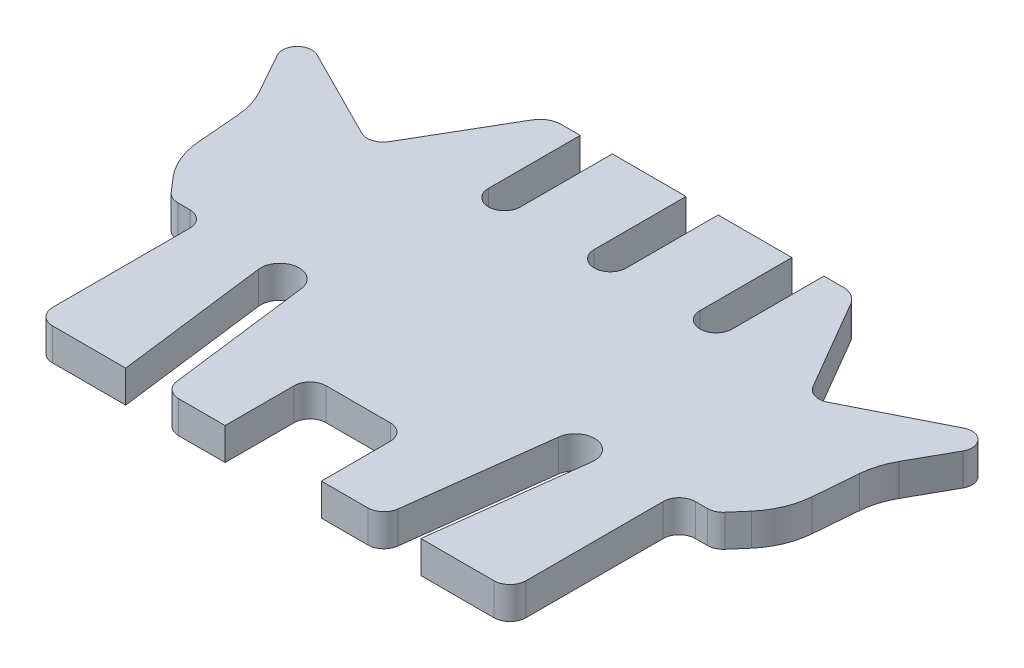
from build123d import *

# Parameters (mm, degrees)
BOSS_EXTRUDE1_DEPTH = 3
FILLET1_R           = 1.5
FILLET2_R           = 7
FILLET3_R           = 2


with BuildPart() as part:
    # Sketch1 → Boss-Extrude1 (new body)
    with BuildSketch(Plane(origin=(0, 0, 0), x_dir=(1, 0, 0), z_dir=(0, 1, 0))):
        with BuildLine():
            Line((-4.5, 7.94), (4.5, 7.94))
            Line((4.5, 7.94), (4.5, 0))
            Line((4.5, 0), (10.165, 0))
            Line((10.165, 0), (12.015, 14.649700441))
            ThreePointArc((12.015, 14.649700441), (14.026334206, 16.21), (15.586633764, 14.198665794))
            Line((15.586633764, 14.198665794), (13.793591523, 0))
            Line((13.793591523, 0), (22.124537234, 0))
            Line((22.124537234, 0), (22.124537234, 15.82))
            Line((22.124537234, 15.82), (25.434537234, 15.82))
            Line((25.434537234, 15.82), (28.504537234, 19.38))
            Line((28.504537234, 19.38), (29.164537234, 27.27))
            Line((29.164537234, 27.27), (32.041780145, 32.418380087))
            ThreePointArc((32.041780145, 32.418380087), (31.835, 34.03463387), (30.229008776, 34.31))
            Line((30.229008776, 34.31), (20.525, 29.416544335))
            Line((20.525, 29.416544335), (14.31, 40.08))
            Line((14.31, 40.08), (11.39, 40.08))
            Line((11.39, 40.08), (11.39, 31.5))
            ThreePointArc((11.39, 31.5), (9.89, 30), (8.39, 31.5))
            Line((8.39, 31.5), (8.39, 40.08))
            Line((8.39, 40.08), (1.5, 40.08))
            Line((1.5, 40.08), (1.5, 31.5))
            ThreePointArc((1.5, 31.5), (0, 30), (-1.5, 31.5))
            Line((-1.5, 31.5), (-1.5, 40.08))
            Line((-1.5, 40.08), (-8.39, 40.08))
            Line((-8.39, 40.08), (-8.39, 31.5))
            ThreePointArc((-8.39, 31.5), (-9.89, 30), (-11.39, 31.5))
            Line((-11.39, 31.5), (-11.39, 40.08))
            Line((-11.39, 40.08), (-14.31, 40.08))
            Line((-14.31, 40.08), (-20.525, 29.416544335))
            Line((-20.525, 29.416544335), (-30.229008776, 34.31))
            ThreePointArc((-30.229008776, 34.31), (-31.835, 34.03463387), (-32.041780145, 32.418380087))
            Line((-32.041780145, 32.418380087), (-29.164537234, 27.27))
            Line((-29.164537234, 27.27), (-28.504537234, 19.38))
            Line((-28.504537234, 19.38), (-25.434537234, 15.82))
            Line((-25.434537234, 15.82), (-22.124537234, 15.82))
            Line((-22.124537234, 15.82), (-22.124537234, 0))
            Line((-22.124537234, 0), (-13.793591523, 0))
            Line((-13.793591523, 0), (-15.586633764, 14.198665794))
            ThreePointArc((-15.586633764, 14.198665794), (-14.026334206, 16.21), (-12.015, 14.649700441))
            Line((-12.015, 14.649700441), (-10.165, 0))
            Line((-10.165, 0), (-4.5, 0))
            Line((-4.5, 0), (-4.5, 7.94))
        make_face()
    extrude(amount=BOSS_EXTRUDE1_DEPTH)

    # Fillet1
    fillet1_edges = [part.edges().sort_by_distance(p)[0] for p in [
        (4.5, 1.5, -7.94),
        (-4.5, 1.5, -7.94),
        (-10.165, 1.5, 0),
        (-22.124537234, 1.5, 0),
        (-22.124537234, 1.5, -15.82),
        (-25.434537234, 1.5, -15.82),
        (-20.525, 1.5, -29.416544335),
        (20.525, 1.5, -29.416544335),
        (25.434537234, 1.5, -15.82),
        (22.124537234, 1.5, -15.82),
        (22.124537234, 1.5, 0),
        (10.165, 1.5, 0),
    ]]
    fillet(fillet1_edges, radius=FILLET1_R)

    # Fillet2
    fillet2_edges = [part.edges().sort_by_distance(p)[0] for p in [
        (-28.504537234, 1.5, -19.38),
        (-29.164537234, 1.5, -27.27),
        (29.164537234, 1.5, -27.27),
        (28.504537234, 1.5, -19.38),
    ]]
    fillet(fillet2_edges, radius=FILLET2_R)

    # Fillet3
    fillet3_edges = [part.edges().sort_by_distance(p)[0] for p in [
        (-14.31, 1.5, -40.08),
        (14.31, 1.5, -40.08),
    ]]
    fillet(fillet3_edges, radius=FILLET3_R)


solid = part.part
